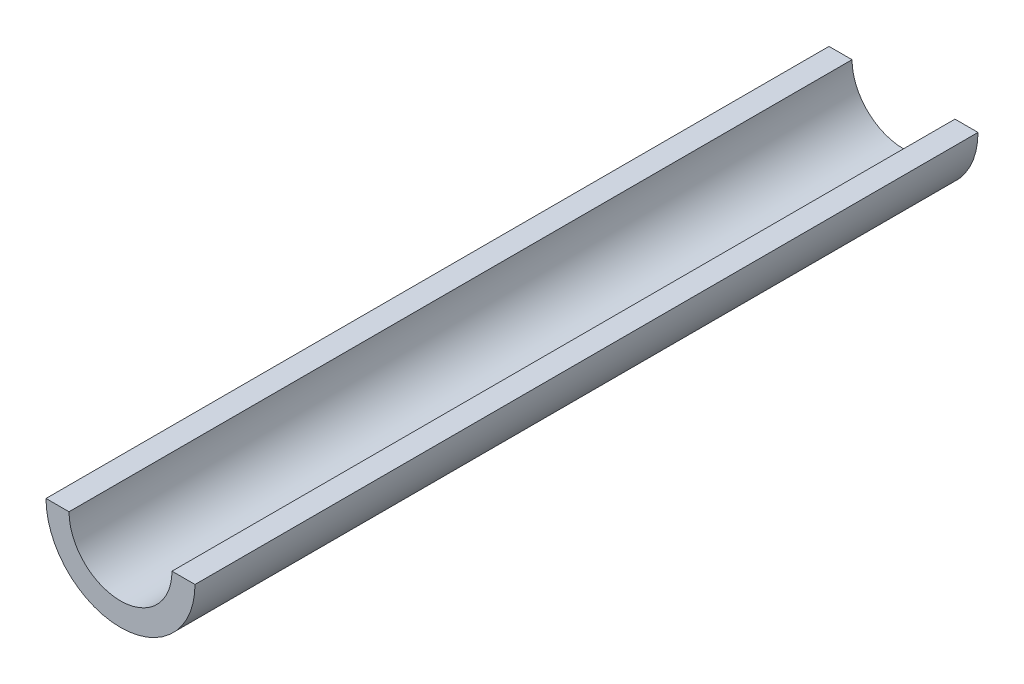
from build123d import *

# Parameters (mm, degrees)
BOSS_EXTRUDE1_DEPTH = 170


with BuildPart() as part:
    # Sketch1 → Boss-Extrude1 (new body)
    with BuildSketch(Plane.XY):
        with BuildLine():
            Line((-16.175, 0), (-11.175, 0))
            ThreePointArc((-11.175, 0), (0, -11.175), (11.175, 0))
            Line((11.175, 0), (16.175, 0))
            ThreePointArc((16.175, 0), (0, -16.175), (-16.175, 0))
        make_face()
    extrude(amount=BOSS_EXTRUDE1_DEPTH)


solid = part.part
